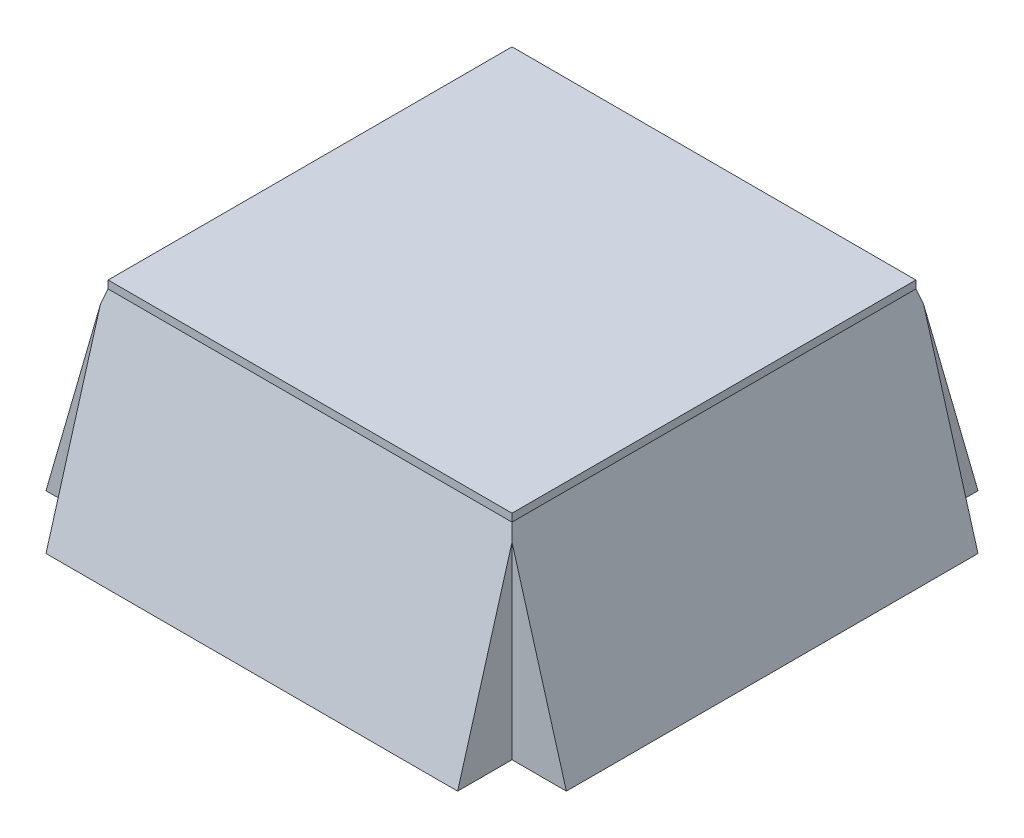
from build123d import *

# Parameters (mm, degrees)
SALIENTE_EXTRUIR1_DEPTH    = 67
CORTAR_EXTRUIR1_DEPTH      = 107
CORTAR_EXTRUIR2_DEPTH      = 107
CORTAR_EXTRUIR3_DEPTH      = 25
CORTAR_EXTRUIR3_DEPTH_BACK = 25
CORTAR_EXTRUIR4_DEPTH      = 25
CORTAR_EXTRUIR4_DEPTH_BACK = 25
CROQUIS14_W                = 7
CROQUIS14_H                = 7
CORTAR_EXTRUIR6_DEPTH      = 70
CROQUIS15_W                = 52
CROQUIS15_H                = 52
SALIENTE_EXTRUIR10_DEPTH   = 1


with BuildPart() as part:
    # Croquis1 → Saliente-Extruir1 (new body)
    with BuildSketch(Plane.XY):
        Polygon((0, 0), (67, 0), (59.5, 26), (7.5, 26), align=None)
    extrude(amount=SALIENTE_EXTRUIR1_DEPTH)

    # Croquis3 → Cortar-Extruir1 (cut)
    with BuildSketch(Plane(origin=(0, 0, 0), x_dir=(0, 0, -1), z_dir=(1, 0, 0))):
        Polygon((-67, 0), (-59.5, 26), (-67, 26), align=None)
        Polygon((0, 0), (-7.5, 26), (0, 26), align=None)
    extrude(amount=CORTAR_EXTRUIR1_DEPTH, mode=Mode.SUBTRACT)

    # Croquis5 → Cortar-Extruir2 (cut)
    with BuildSketch(Plane(origin=(0, 26, 0), x_dir=(1, 0, 0), z_dir=(0, 1, 0))):
        with BuildLine():
            Line((33, -32.354356076), (33, -8.5))
            Line((33, -8.5), (8.5, -8.5))
            Line((8.5, -8.5), (8.5, -58.5))
            Line((8.5, -58.5), (58.5, -58.5))
            Line((58.5, -58.5), (58.5, -8.5))
            Line((58.5, -8.5), (34, -8.5))
            Line((34, -8.5), (34, -32.354356076))
            ThreePointArc((34, -32.354356076), (33.5, -34.75), (33, -32.354356076))
        make_face()
    extrude(amount=-CORTAR_EXTRUIR2_DEPTH, mode=Mode.SUBTRACT)

    # Croquis6 → Cortar-Extruir3 (cut, two sides: drawn at the far end of the back side and taken through both)
    with BuildSketch(Plane(origin=(33.5, 0, 0), x_dir=(0, 0, -1), z_dir=(1, 0, 0)).offset(-CORTAR_EXTRUIR3_DEPTH_BACK)):
        Polygon((-65.711538462, 0), (-58.5, 25), (-8.5, 25), (-1.288461538, 0), align=None)
    extrude(amount=CORTAR_EXTRUIR3_DEPTH + CORTAR_EXTRUIR3_DEPTH_BACK, mode=Mode.SUBTRACT)

    # Croquis7 → Cortar-Extruir4 (cut, two sides: drawn at the far end of the back side and taken through both)
    with BuildSketch(Plane.XY.offset(33.5).offset(-CORTAR_EXTRUIR4_DEPTH_BACK)):
        Polygon((1.288461538, 0), (8.5, 25), (58.5, 25), (65.711538462, 0), align=None)
    extrude(amount=CORTAR_EXTRUIR4_DEPTH + CORTAR_EXTRUIR4_DEPTH_BACK, mode=Mode.SUBTRACT)

    # Croquis14 → Cortar-Extruir6 (cut)
    with BuildSketch(Plane.XZ):
        with Locations((63.5, 3.5)):
            Rectangle(CROQUIS14_W, CROQUIS14_H)
        with Locations((63.5, 63.5)):
            Rectangle(CROQUIS14_W, CROQUIS14_H)
        with Locations((3.5, 3.5)):
            Rectangle(CROQUIS14_W, CROQUIS14_H)
        with Locations((3.5, 63.5)):
            Rectangle(CROQUIS14_W, CROQUIS14_H)
    extrude(amount=-CORTAR_EXTRUIR6_DEPTH, mode=Mode.SUBTRACT)

    # Croquis15 → Saliente-Extruir10 (add)
    with BuildSketch(Plane(origin=(0, 26, 0), x_dir=(1, 0, 0), z_dir=(0, 1, 0))):
        with Locations((33.5, -33.5)):
            Rectangle(CROQUIS15_W, CROQUIS15_H)
    extrude(amount=SALIENTE_EXTRUIR10_DEPTH)


solid = part.part
